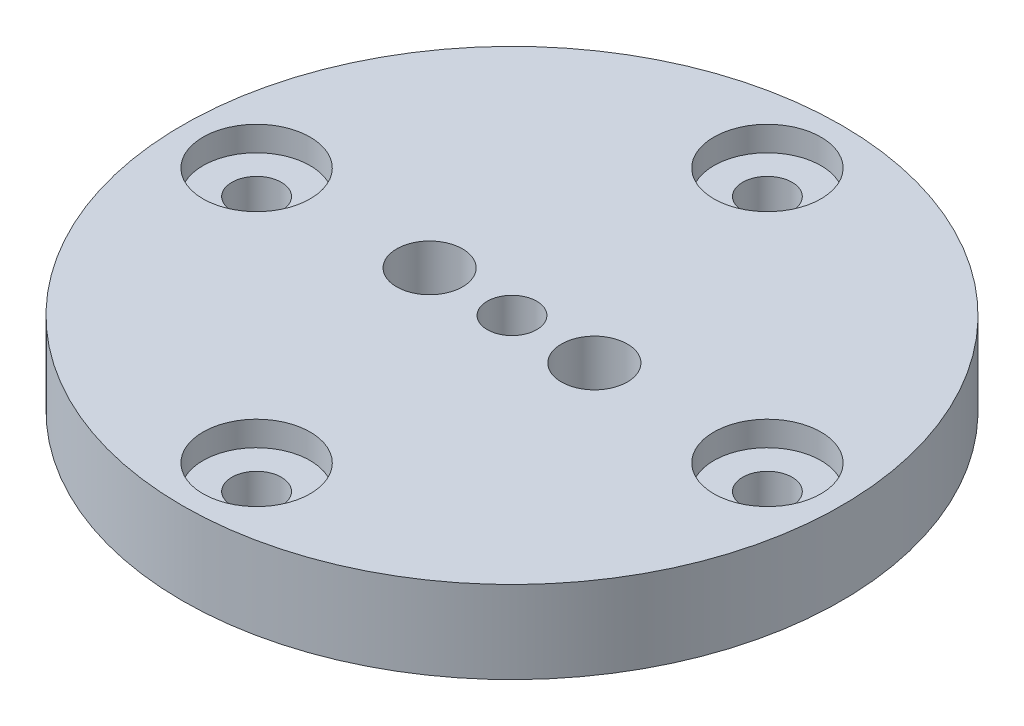
from build123d import *

# Parameters (mm, degrees)
SKETCH1_R           = 20
SKETCH1_R_2         = 1.5
SKETCH1_R_3         = 2
BOSS_EXTRUDE1_DEPTH = 5
SKETCH2_R           = 3.25
CUT_EXTRUDE1_DEPTH  = 1.5


with BuildPart() as part:
    # Sketch1 → Boss-Extrude1 (new body)
    with BuildSketch(Plane(origin=(0, 0, 0), x_dir=(1, 0, 0), z_dir=(0, 1, 0))):
        with Locations(Location((0, 0, 0), (0, 0, 270))):
            Circle(SKETCH1_R)
        with Locations(Location((0, 15.5, 0), (0, 0, 270))):
            Circle(SKETCH1_R_2, mode=Mode.SUBTRACT)
        with Locations(Location((15.5, 0, 0), (0, 0, 270))):
            Circle(SKETCH1_R_2, mode=Mode.SUBTRACT)
        with Locations(Location((0, -15.5, 0), (0, 0, 270))):
            Circle(SKETCH1_R_2, mode=Mode.SUBTRACT)
        with Locations(Location((-15.5, 0, 0), (0, 0, 270))):
            Circle(SKETCH1_R_2, mode=Mode.SUBTRACT)
        with Locations(Location((-5, 0, 0), (0, 0, 270))):
            Circle(SKETCH1_R_3, mode=Mode.SUBTRACT)
        with Locations(Location((5, 0, 0), (0, 0, 270))):
            Circle(SKETCH1_R_3, mode=Mode.SUBTRACT)
        with Locations(Location((0, 0, 0), (0, 0, 270))):
            Circle(SKETCH1_R_2, mode=Mode.SUBTRACT)
    extrude(amount=BOSS_EXTRUDE1_DEPTH)

    # Sketch2 → Cut-Extrude1 (cut)
    with BuildSketch(Plane(origin=(0, 5, 0), x_dir=(1, 0, 0), z_dir=(0, 1, 0))):
        with Locations(Location((0, 15.5, 0), (0, 0, 270))):
            Circle(SKETCH2_R)
        with Locations(Location((15.5, 0, 0), (0, 0, 270))):
            Circle(SKETCH2_R)
        with Locations(Location((0, -15.5, 0), (0, 0, 270))):
            Circle(SKETCH2_R)
        with Locations(Location((-15.5, 0, 0), (0, 0, 270))):
            Circle(SKETCH2_R)
    extrude(amount=-CUT_EXTRUDE1_DEPTH, mode=Mode.SUBTRACT)


solid = part.part
